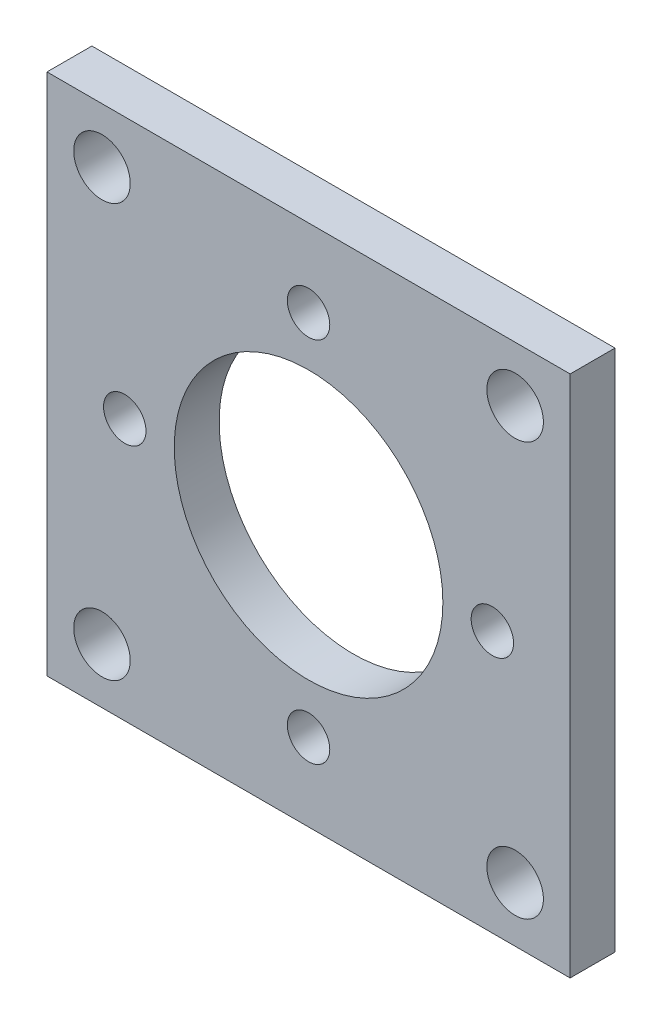
from build123d import *

# Parameters (mm, degrees)
SKETCH1_W           = 37
SKETCH1_H           = 37
BOSS_EXTRUDE1_DEPTH = 3.175
SKETCH2_R           = 9.5
CUT_EXTRUDE1_DEPTH  = 27.354897552
SKETCH3_R           = 1.5
CUT_EXTRUDE2_DEPTH  = 27.354897552
SKETCH4_R           = 2
CUT_EXTRUDE3_DEPTH  = 27.354897552


with BuildPart() as part:
    # Sketch1 → Boss-Extrude1 (new body)
    with BuildSketch(Plane.XY):
        Rectangle(SKETCH1_W, SKETCH1_H)
    extrude(amount=BOSS_EXTRUDE1_DEPTH)

    # Sketch2 → Cut-Extrude1 (cut, through all)
    with BuildSketch(Plane.XY.offset(3.175)):
        Circle(SKETCH2_R)
    extrude(amount=-CUT_EXTRUDE1_DEPTH, mode=Mode.SUBTRACT)

    # Sketch3 → Cut-Extrude2 (cut, through all)
    with BuildSketch(Plane.XY.offset(3.175)):
        with Locations((-13, 0)):
            Circle(SKETCH3_R)
        with Locations((0, 13)):
            Circle(SKETCH3_R)
        with Locations((13, 0)):
            Circle(SKETCH3_R)
        with Locations((0, -13)):
            Circle(SKETCH3_R)
    extrude(amount=-CUT_EXTRUDE2_DEPTH, mode=Mode.SUBTRACT)

    # Sketch4 → Cut-Extrude3 (cut, through all)
    with BuildSketch(Plane.XY.offset(3.175)):
        with Locations((-14.610912703, 14.610912703)):
            Circle(SKETCH4_R)
        with Locations((14.610912703, 14.610912703)):
            Circle(SKETCH4_R)
        with Locations((14.610912703, -14.610912703)):
            Circle(SKETCH4_R)
        with Locations((-14.610912703, -14.610912703)):
            Circle(SKETCH4_R)
    extrude(amount=-CUT_EXTRUDE3_DEPTH, mode=Mode.SUBTRACT)


solid = part.part
